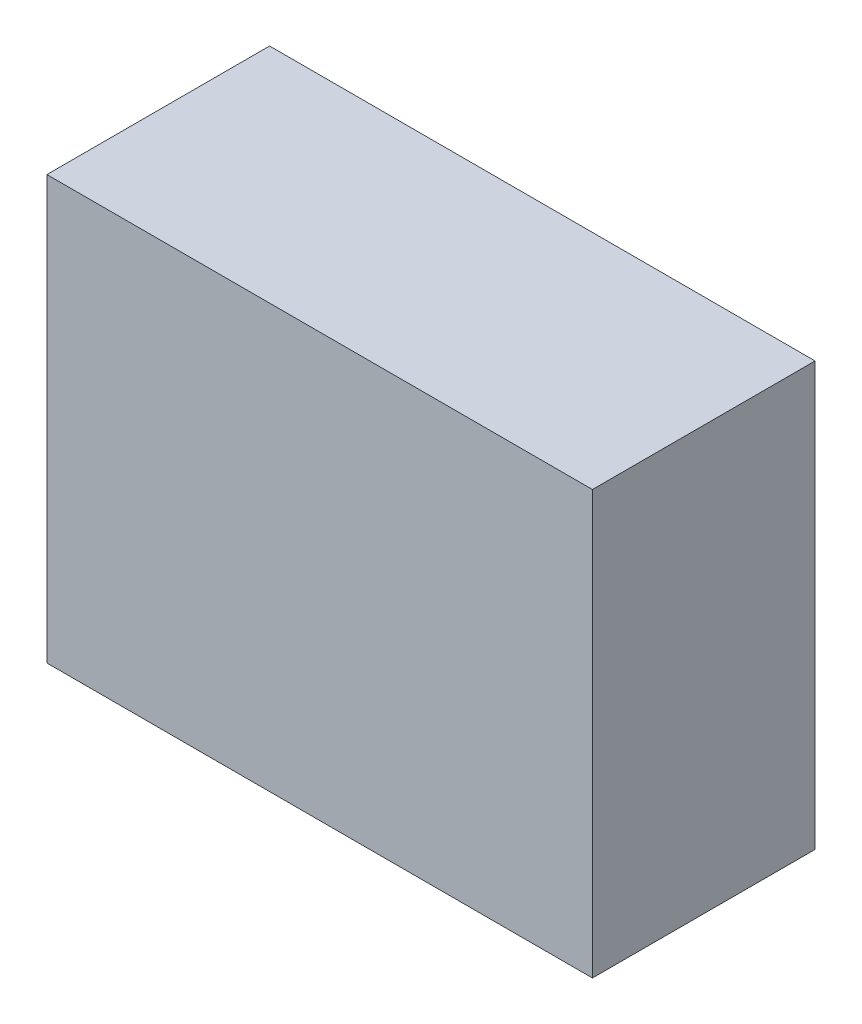
from build123d import *

# Parameters (mm, degrees)
SKETCH1_W           = 76
SKETCH1_H           = 98
BOSS_EXTRUDE1_DEPTH = 40


with BuildPart() as part:
    # Sketch1 → Boss-Extrude1 (new body)
    with BuildSketch(Plane(origin=(0, 0, 0), x_dir=(0, 1, 0), z_dir=(0, 0, 1))):
        Rectangle(SKETCH1_W, SKETCH1_H)
    extrude(amount=BOSS_EXTRUDE1_DEPTH)


solid = part.part
